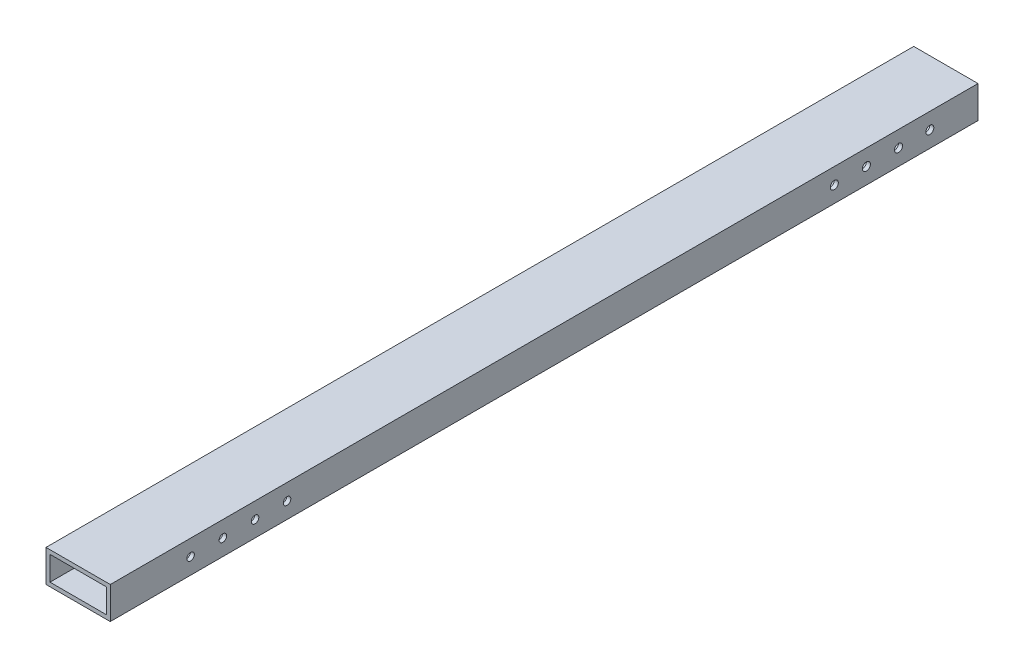
from build123d import *

# Parameters (mm, degrees)
BOSS_EXTRUDE1_DEPTH         = 342.9
BOSS_EXTRUDE1_DEPTH_BACK    = 342.9
SKETCH3_W                   = 50.8
SKETCH3_H                   = 25.4
SKETCH3_W_2                 = 44.45
SKETCH3_H_2                 = 19.05
A_0_234_DIAMETER_HOLE1_D    = 5.9436
F_1_4_0_25_DIAMETER_HOLE2_D = 6.35


with BuildPart() as part:
    # Sketch3 → Boss-Extrude1 (new, two sides: drawn at the far end of the back side and taken through both)
    with BuildSketch(Plane.XY.offset(-BOSS_EXTRUDE1_DEPTH_BACK)):
        Rectangle(SKETCH3_W, SKETCH3_H)
        Rectangle(SKETCH3_W_2, SKETCH3_H_2, mode=Mode.SUBTRACT)
    extrude(amount=BOSS_EXTRUDE1_DEPTH + BOSS_EXTRUDE1_DEPTH_BACK)

    # A (0.234) Diameter Hole1 (through all)
    with Locations(Plane(origin=(25.4, 0, 0), x_dir=(0, 0, -1), z_dir=(1, 0, 0))):
        with Locations((-279.4, 0), (-253.907466118, 0), (-228.493320952, 0), (-203.196291662, 0)):
            Hole(A_0_234_DIAMETER_HOLE1_D / 2)

    # 1/4 (0.25) Diameter Hole2 (through all)
    with Locations(Plane(origin=(25.4, 0, 0), x_dir=(0, 0, -1), z_dir=(1, 0, 0))):
        with Locations((304.8, 0), (280.111799988, 0), (254.711799988, 0), (229.311799988, 0)):
            Hole(F_1_4_0_25_DIAMETER_HOLE2_D / 2)


solid = part.part
